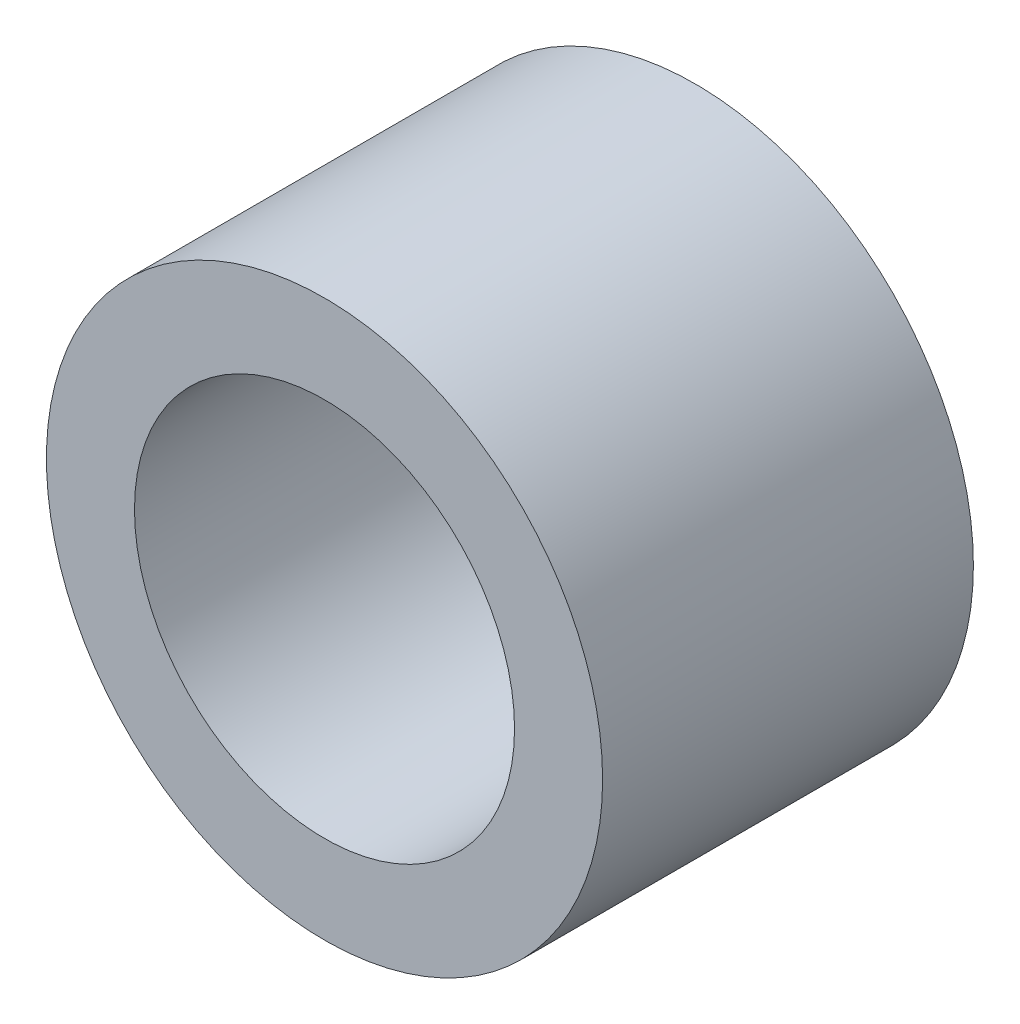
from build123d import *

# Parameters (mm, degrees)
PROFILE_1_R   = 6
PROFILE_1_R_2 = 4.1
SLEEVE_DEPTH  = 8


with BuildPart() as part:
    # Profile_1 → Sleeve (new body)
    with BuildSketch(Plane.XY):
        Circle(PROFILE_1_R)
        Circle(PROFILE_1_R_2, mode=Mode.SUBTRACT)
    extrude(amount=SLEEVE_DEPTH)


solid = part.part
